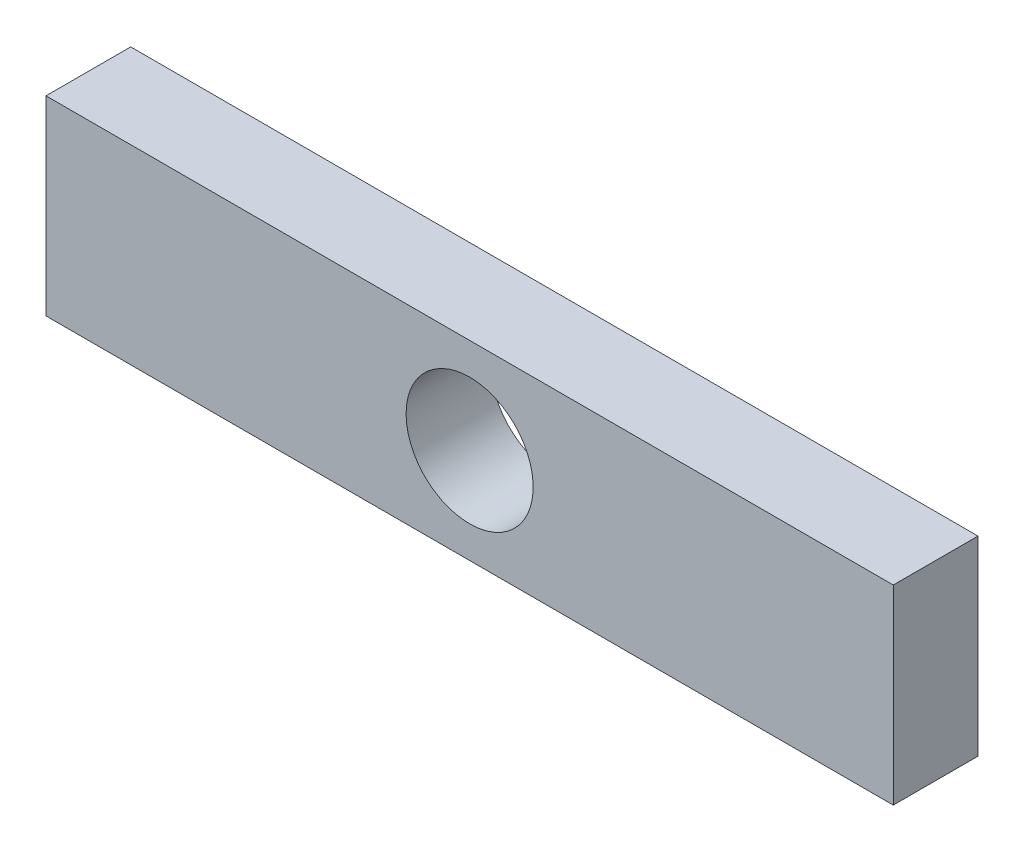
from build123d import *

# Parameters (mm, degrees)
SKETCH1_W           = 40
SKETCH1_H           = 4
BOSS_EXTRUDE1_DEPTH = 9
CUT_EXTRUDE1_REACH  = 43.195
SKETCH2_R           = 3


with BuildPart() as part:
    # Sketch1 → Boss-Extrude1 (new body)
    with BuildSketch(Plane(origin=(0, 0, 0), x_dir=(1, 0, 0), z_dir=(0, 1, 0))):
        with Locations((20, 2)):
            Rectangle(SKETCH1_W, SKETCH1_H)
    extrude(amount=BOSS_EXTRUDE1_DEPTH)

    # Sketch2 → Cut-Extrude1 (cut, up to next)
    with BuildSketch(Plane(origin=(0, 0, -4), x_dir=(-1, 0, 0), z_dir=(0, 0, -1)), mode=Mode.PRIVATE) as cut_extrude1_sk1:
        with Locations((-20, 4.5)):
            Circle(SKETCH2_R)
    cut_extrude1_tool1 = extrude(cut_extrude1_sk1.sketch, amount=-CUT_EXTRUDE1_REACH, mode=Mode.PRIVATE) & part.part
    add(cut_extrude1_tool1.solids().sort_by_distance((20, 4.5, -4))[0], mode=Mode.SUBTRACT)


solid = part.part
